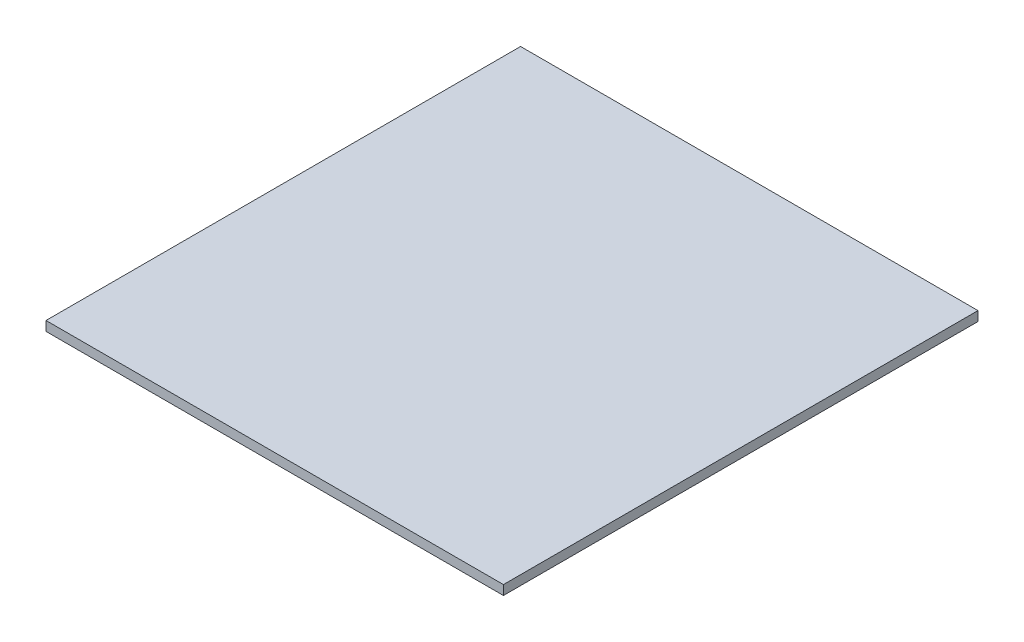
from build123d import *

# Parameters (mm, degrees)
SKETCH2_W           = 144.58
SKETCH2_H           = 3
BOSS_EXTRUDE1_DEPTH = 150


with BuildPart() as part:
    # Sketch2 → Boss-Extrude1 (new body)
    with BuildSketch(Plane.XY):
        with Locations((72.29, -1.5)):
            Rectangle(SKETCH2_W, SKETCH2_H)
    extrude(amount=BOSS_EXTRUDE1_DEPTH)


solid = part.part
